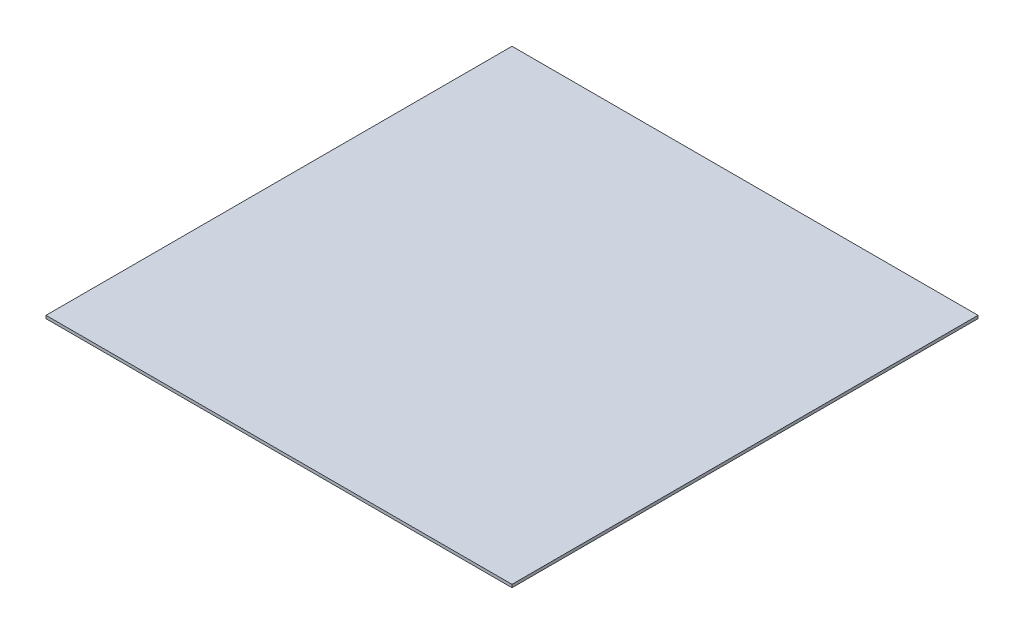
from build123d import *

# Parameters (mm, degrees)
PACK_PLUNGER_PLAKASI_316X316X2_1_START = -242
SKETCH1_W                              = 316
SKETCH1_H                              = 2
PACK_PLUNGER_PLAKASI_316X316X2_1_DEPTH = 316


with BuildPart() as part:
    # Sketch1 → PACK_plunger_plakasi_316x316x2_1 (new body)
    with BuildSketch(Plane.XY.offset(PACK_PLUNGER_PLAKASI_316X316X2_1_START)):
        with Locations((350, 507)):
            Rectangle(SKETCH1_W, SKETCH1_H)
    extrude(amount=-PACK_PLUNGER_PLAKASI_316X316X2_1_DEPTH)


solid = part.part
